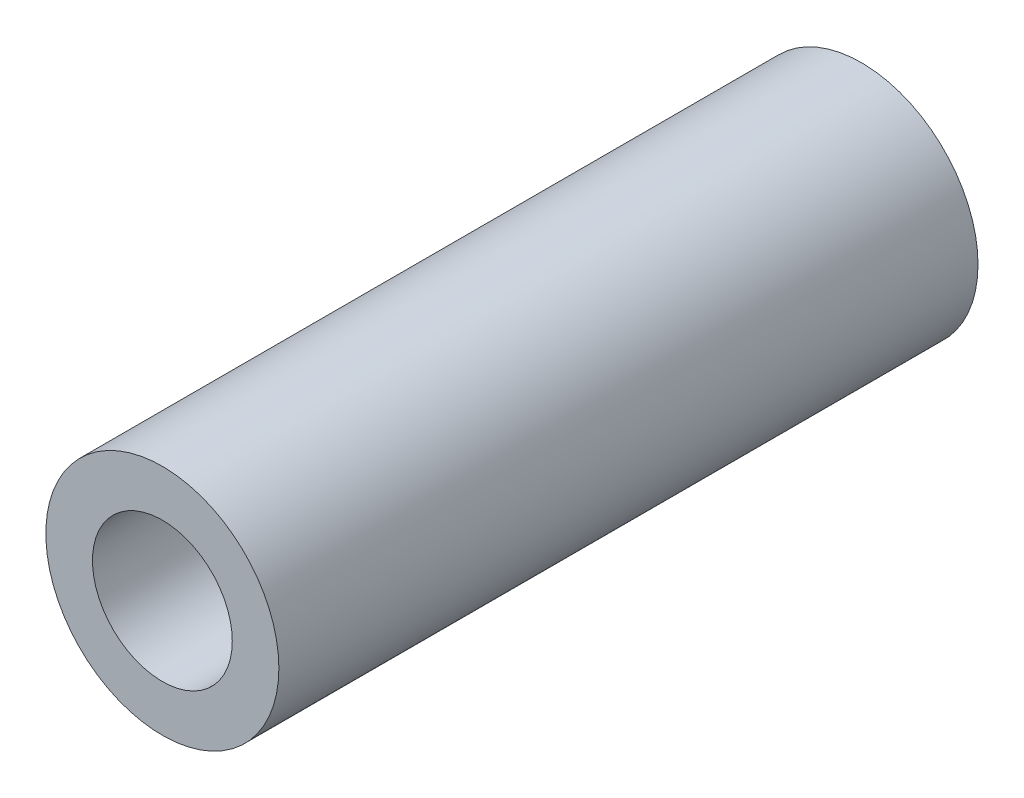
from build123d import *

# Parameters (mm, degrees)
CROQUIS1_R              = 2.5
CROQUIS1_R_2            = 1.5
SALIENTE_EXTRUIR1_DEPTH = 15


with BuildPart() as part:
    # Croquis1 → Saliente-Extruir1 (new body)
    with BuildSketch(Plane.XY):
        Circle(CROQUIS1_R)
        Circle(CROQUIS1_R_2, mode=Mode.SUBTRACT)
    extrude(amount=SALIENTE_EXTRUIR1_DEPTH)


solid = part.part
